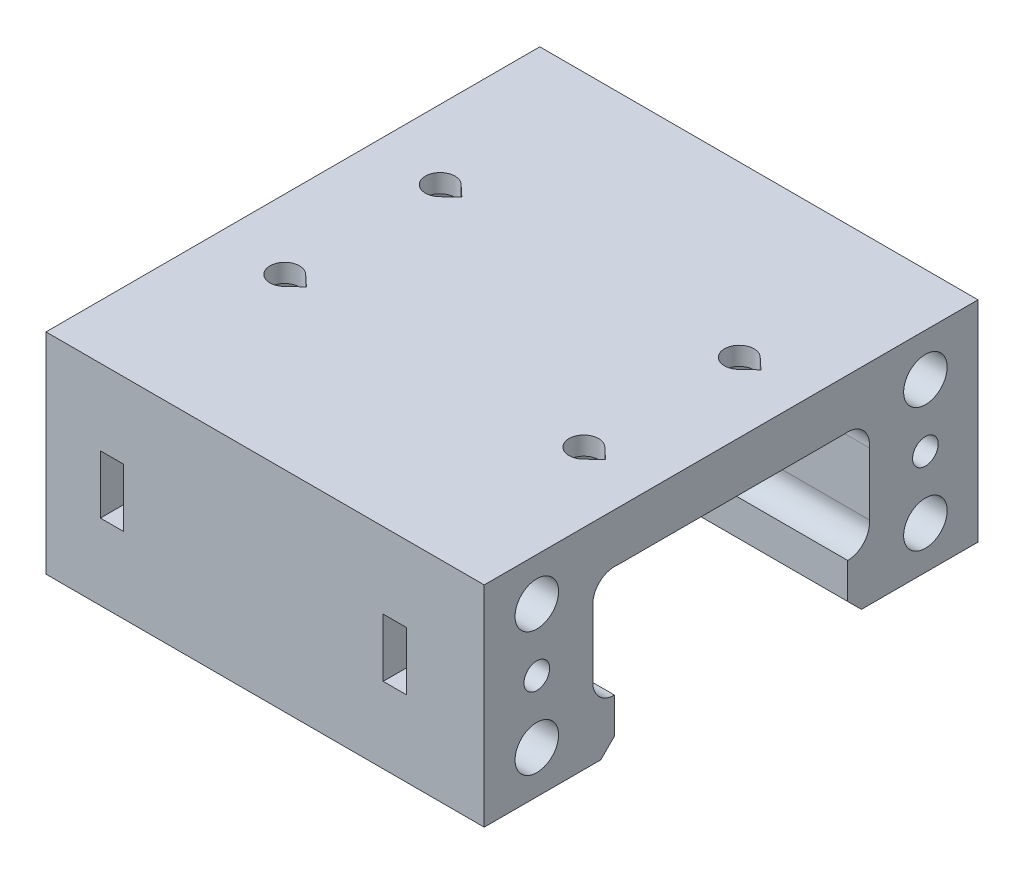
from build123d import *

# Parameters (mm, degrees)
SKETCH2_R           = 2.778125
BOSS_EXTRUDE2_DEPTH = 56.3835756
SKETCH3_R           = 1.651
CUT_EXTRUDE1_DEPTH  = 23.5668
SKETCH4_W           = 10.767766953
SKETCH4_H           = 3
CUT_EXTRUDE2_DEPTH  = 3.75
SKETCH5_R           = 2.8
CUT_EXTRUDE3_DEPTH  = 80.995318373
CUT_EXTRUDE4_DEPTH  = 77.107177875
CUT_EXTRUDE5_DEPTH  = 4


with BuildPart() as part:
    # Sketch2 → Boss-Extrude2 (new body)
    with BuildSketch(Plane(origin=(0, 0, 0), x_dir=(0, 0, -1), z_dir=(1, 0, 0))):
        with BuildLine():
            Line((0, 25.778125), (30, 25.778125))
            ThreePointArc((30, 25.778125), (31.964431026, 24.964431026), (32.778125, 23))
            Line((32.778125, 23), (32.778125, 14.278125))
            ThreePointArc((32.778125, 14.278125), (31.964431026, 12.313693974), (30, 11.5))
            Line((30, 11.5), (30, 6.906829453))
            Line((30, 6.906829453), (31.767766953, 5.1390625))
            Line((31.767766953, 5.1390625), (46.767766953, 5.1390625))
            Line((46.767766953, 5.1390625), (46.767766953, 32.1390625))
            Line((46.767766953, 32.1390625), (-16.767766953, 32.1390625))
            Line((-16.767766953, 32.1390625), (-16.767766953, 5.1390625))
            Line((-16.767766953, 5.1390625), (-1.767766953, 5.1390625))
            Line((-1.767766953, 5.1390625), (0, 6.906829453))
            Line((0, 6.906829453), (0, 11.5))
            ThreePointArc((0, 11.5), (-1.964431026, 12.313693974), (-2.778125, 14.278125))
            Line((-2.778125, 14.278125), (-2.778125, 23))
            ThreePointArc((-2.778125, 23), (-1.964431026, 24.964431026), (0, 25.778125))
        make_face()
        with Locations((-10, 26.6390625)):
            Circle(SKETCH2_R, mode=Mode.SUBTRACT)
        with Locations((-10, 10.6390625)):
            Circle(SKETCH2_R, mode=Mode.SUBTRACT)
        with Locations((40, 10.6390625)):
            Circle(SKETCH2_R, mode=Mode.SUBTRACT)
        with Locations((40, 26.6390625)):
            Circle(SKETCH2_R, mode=Mode.SUBTRACT)
    extrude(amount=BOSS_EXTRUDE2_DEPTH)

    # Sketch3 → Cut-Extrude1 (cut)
    with BuildSketch(Plane(origin=(56.3835756, 0, 0), x_dir=(0, 0, -1), z_dir=(1, 0, 0))):
        with Locations((-10, 18.6390625)):
            Circle(SKETCH3_R)
        with Locations((40, 18.6390625)):
            Circle(SKETCH3_R)
    cut_extrude1 = extrude(amount=-CUT_EXTRUDE1_DEPTH, mode=Mode.SUBTRACT)

    # Sketch4 → Cut-Extrude2 (cut, symmetric)
    with BuildSketch(Plane(origin=(0, 18.6390625, 0), x_dir=(0, 0, -1), z_dir=(0, -1, 0))):
        with Locations((-11.383883477, 44.8835756)):
            Rectangle(SKETCH4_W, SKETCH4_H)
        with Locations((41.383883477, 44.8835756)):
            Rectangle(SKETCH4_W, SKETCH4_H)
        with Locations((-11.383883477, 8.5)):
            Rectangle(SKETCH4_W, SKETCH4_H)
        with Locations((41.383883477, 8.5)):
            Rectangle(SKETCH4_W, SKETCH4_H)
    extrude(amount=CUT_EXTRUDE2_DEPTH, both=True, mode=Mode.SUBTRACT)

    # Sketch5 → Cut-Extrude3 (cut, through all)
    with BuildSketch(Plane(origin=(56.3835756, 0, 0), x_dir=(0, 0, -1), z_dir=(1, 0, 0))):
        with Locations((-10, 26.6390625)):
            Circle(SKETCH5_R)
        with Locations((0, 23)):
            Circle(SKETCH5_R)
        with Locations((-10, 10.6390625)):
            Circle(SKETCH5_R)
        with Locations((40, 26.6390625)):
            Circle(SKETCH5_R)
        with Locations((40, 10.6390625)):
            Circle(SKETCH5_R)
        with Locations((30, 23)):
            Circle(SKETCH5_R)
        with Locations((0, 14.278125)):
            Circle(SKETCH5_R)
        with Locations((30, 14.278125)):
            Circle(SKETCH5_R)
    extrude(amount=-CUT_EXTRUDE3_DEPTH, mode=Mode.SUBTRACT)

    # Mirror1: Cut-Extrude1 across plane
    add(cut_extrude1.mirror(Plane.ZY.offset(-28.1917878)), mode=Mode.SUBTRACT)

    # Sketch6 → Cut-Extrude4 (cut, through all)
    with BuildSketch(Plane.XZ.offset(-25.778125)):
        with BuildLine():
            Line((11.737987423, -5), (10.250411309, -3.608694115))
            ThreePointArc((10.250411309, -3.608694115), (7.044145412, -5), (10.250411309, -6.391305885))
            Line((10.250411309, -6.391305885), (11.737987423, -5))
        make_face()
        with BuildLine():
            Line((50.223272198, -5), (48.735696084, -3.608694115))
            ThreePointArc((48.735696084, -3.608694115), (45.529430188, -5), (48.735696084, -6.391305885))
            Line((48.735696084, -6.391305885), (50.223272198, -5))
        make_face()
        with BuildLine():
            Line((50.223272198, -25), (48.735696084, -26.391305885))
            ThreePointArc((48.735696084, -26.391305885), (45.529430188, -25), (48.735696084, -23.608694115))
            Line((48.735696084, -23.608694115), (50.223272198, -25))
        make_face()
        with BuildLine():
            Line((11.737987423, -25), (10.250411309, -23.608694115))
            ThreePointArc((10.250411309, -23.608694115), (7.044145412, -25), (10.250411309, -26.391305885))
            Line((10.250411309, -26.391305885), (11.737987423, -25))
        make_face()
    extrude(amount=-CUT_EXTRUDE4_DEPTH, mode=Mode.SUBTRACT)

    # Sketch7 → Cut-Extrude5 (cut)
    with BuildSketch(Plane(origin=(0, 25.778125, 0), x_dir=(-1, 0, 0), z_dir=(0, -1, 0))):
        Polygon((-10.921547137, 28.4163), (-12.893948862, 25), (-10.921547137, 21.5837), (-6.976743688, 21.5837), (-5.004341963, 25), (-6.976743688, 28.4163), align=None)
        Polygon((-10.921547137, 8.4163), (-12.893948862, 5), (-10.921547137, 1.5837), (-6.976743688, 1.5837), (-5.004341963, 5), (-6.976743688, 8.4163), align=None)
        Polygon((-45.462028463, 8.4163), (-49.406831912, 8.4163), (-51.379233637, 5), (-49.406831912, 1.5837), (-45.462028463, 1.5837), (-43.489626738, 5), align=None)
        Polygon((-45.462028463, 28.4163), (-49.406831912, 28.4163), (-51.379233637, 25), (-49.406831912, 21.5837), (-45.462028463, 21.5837), (-43.489626738, 25), align=None)
    extrude(amount=-CUT_EXTRUDE5_DEPTH, mode=Mode.SUBTRACT)


solid = part.part
